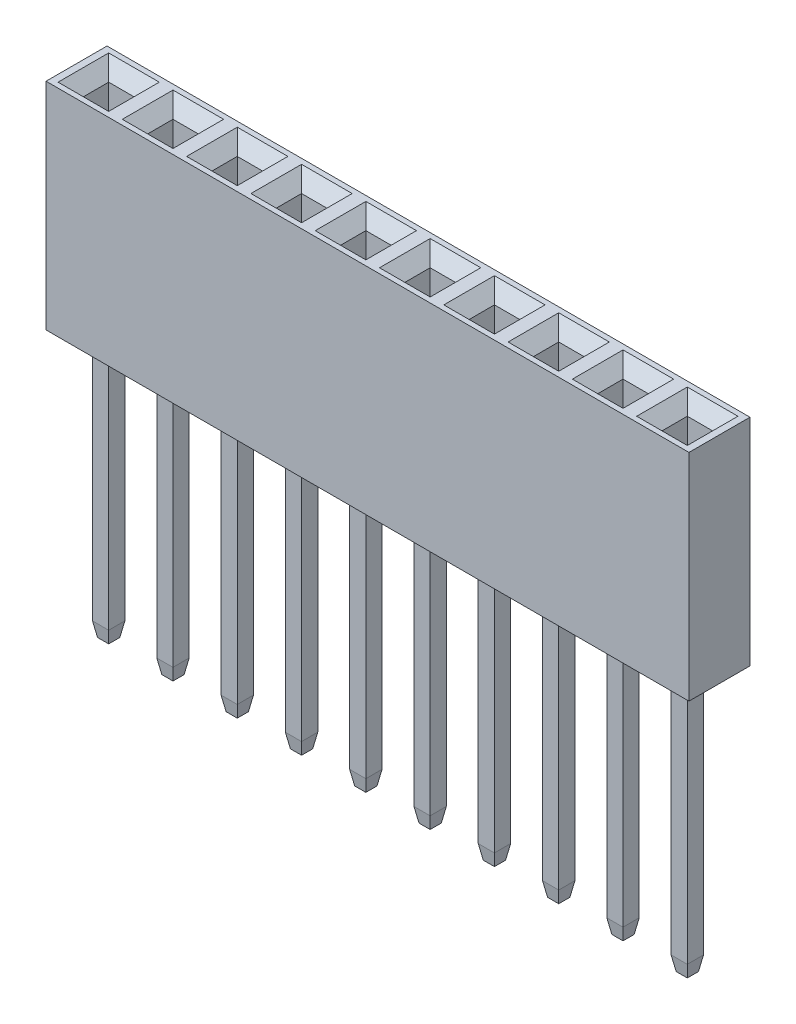
from build123d import *

# Parameters (mm, degrees)
SKETCH2_W                  = 25.4
SKETCH2_H                  = 2.41
BOSS_EXTRUDE1_DEPTH        = 8.51
SKETCH5_W                  = 1
SKETCH5_H                  = 1
CUT_EXTRUDE1_DEPTH         = 5
CHAMFER1_SIZE              = 0.5
LPATTERN3_COUNT            = 10
LPATTERN3_PITCH            = 2.54
CHAMFER1_OF_LPATTERN3_SIZE = 0.5
SKETCH11_W                 = 0.64
SKETCH11_H                 = 0.64
BOSS_EXTRUDE2_DEPTH        = 9.92
LPATTERN4_COUNT            = 10
LPATTERN4_PITCH            = 2.54


with BuildPart() as part:
    # Sketch2 → Boss-Extrude1 (new body)
    with BuildSketch(Plane(origin=(0, 0, 0), x_dir=(1, 0, 0), z_dir=(0, 1, 0))):
        with Locations((11.43, 0)):
            Rectangle(SKETCH2_W, SKETCH2_H)
    extrude(amount=BOSS_EXTRUDE1_DEPTH)

    # Sketch5 → Cut-Extrude1 (cut)
    with BuildSketch(Plane(origin=(0, 8.51, 0), x_dir=(1, 0, 0), z_dir=(0, 1, 0))):
        Rectangle(SKETCH5_W, SKETCH5_H)
    cut_extrude1 = extrude(amount=-CUT_EXTRUDE1_DEPTH, mode=Mode.SUBTRACT)

    # Chamfer1
    chamfer1_edges = [part.edges().sort_by_distance(p)[0] for p in [
        (-0.5, 8.51, 0),
        (0, 8.51, 0.5),
        (0.5, 8.51, 0),
        (0, 8.51, -0.5),
    ]]
    chamfer(chamfer1_edges, length=CHAMFER1_SIZE)

    # LPattern3: Cut-Extrude1 ×10
    with Locations(*[(i * LPATTERN3_PITCH, 0, 0) for i in range(1, LPATTERN3_COUNT)]):
        add(cut_extrude1, mode=Mode.SUBTRACT)

    # Chamfer1 of LPattern3
    chamfer1_of_lpattern3_edges = [part.edges().sort_by_distance(p)[0] for p in [
        (2.04, 8.51, 0),
        (2.54, 8.51, 0.5),
        (3.04, 8.51, 0),
        (2.54, 8.51, -0.5),
        (4.58, 8.51, 0),
        (5.08, 8.51, 0.5),
        (5.58, 8.51, 0),
        (5.08, 8.51, -0.5),
        (7.12, 8.51, 0),
        (7.62, 8.51, 0.5),
        (8.12, 8.51, 0),
        (7.62, 8.51, -0.5),
        (9.66, 8.51, 0),
        (10.16, 8.51, 0.5),
        (10.66, 8.51, 0),
        (10.16, 8.51, -0.5),
        (12.2, 8.51, 0),
        (12.7, 8.51, 0.5),
        (13.2, 8.51, 0),
        (12.7, 8.51, -0.5),
        (14.74, 8.51, 0),
        (15.24, 8.51, 0.5),
        (15.74, 8.51, 0),
        (15.24, 8.51, -0.5),
        (17.28, 8.51, 0),
        (17.78, 8.51, 0.5),
        (18.28, 8.51, 0),
        (17.78, 8.51, -0.5),
        (19.82, 8.51, 0),
        (20.32, 8.51, 0.5),
        (20.82, 8.51, 0),
        (20.32, 8.51, -0.5),
        (22.36, 8.51, 0),
        (22.86, 8.51, 0.5),
        (23.36, 8.51, 0),
        (22.86, 8.51, -0.5),
    ]]
    chamfer(chamfer1_of_lpattern3_edges, length=CHAMFER1_OF_LPATTERN3_SIZE)

    # Sketch11 → Boss-Extrude2 (add)
    with BuildSketch(Plane.XZ):
        Rectangle(SKETCH11_W, SKETCH11_H)
    boss_extrude2 = extrude(amount=BOSS_EXTRUDE2_DEPTH)

    # Sketch13 → Loft1 section 0
    with BuildSketch(Plane.XZ.offset(9.92)):
        with BuildLine():
            Line((0.32, -0.32), (0.32, 0.32))
            Line((0.32, 0.32), (-0.32, 0.32))
            Line((-0.32, 0.32), (-0.32, -0.32))
            Line((-0.32, -0.32), (0.32, -0.32))
        make_face()
    # Sketch14 → Loft1 section 1
    with BuildSketch(Plane(origin=(0, -10.49, 0), x_dir=(-1, 0, 0), z_dir=(0, -1, 0))):
        with BuildLine():
            Line((-0.22, 0.22), (0.22, 0.22))
            Line((0.22, 0.22), (0.22, -0.22))
            Line((0.22, -0.22), (-0.22, -0.22))
            Line((-0.22, -0.22), (-0.22, 0.22))
        make_face()
    loft1 = loft()

    # LPattern4: Boss-Extrude2, Loft1 ×10
    with Locations(*[(i * LPATTERN4_PITCH, 0, 0) for i in range(1, LPATTERN4_COUNT)]):
        add(boss_extrude2)
        add(loft1)


solid = part.part
